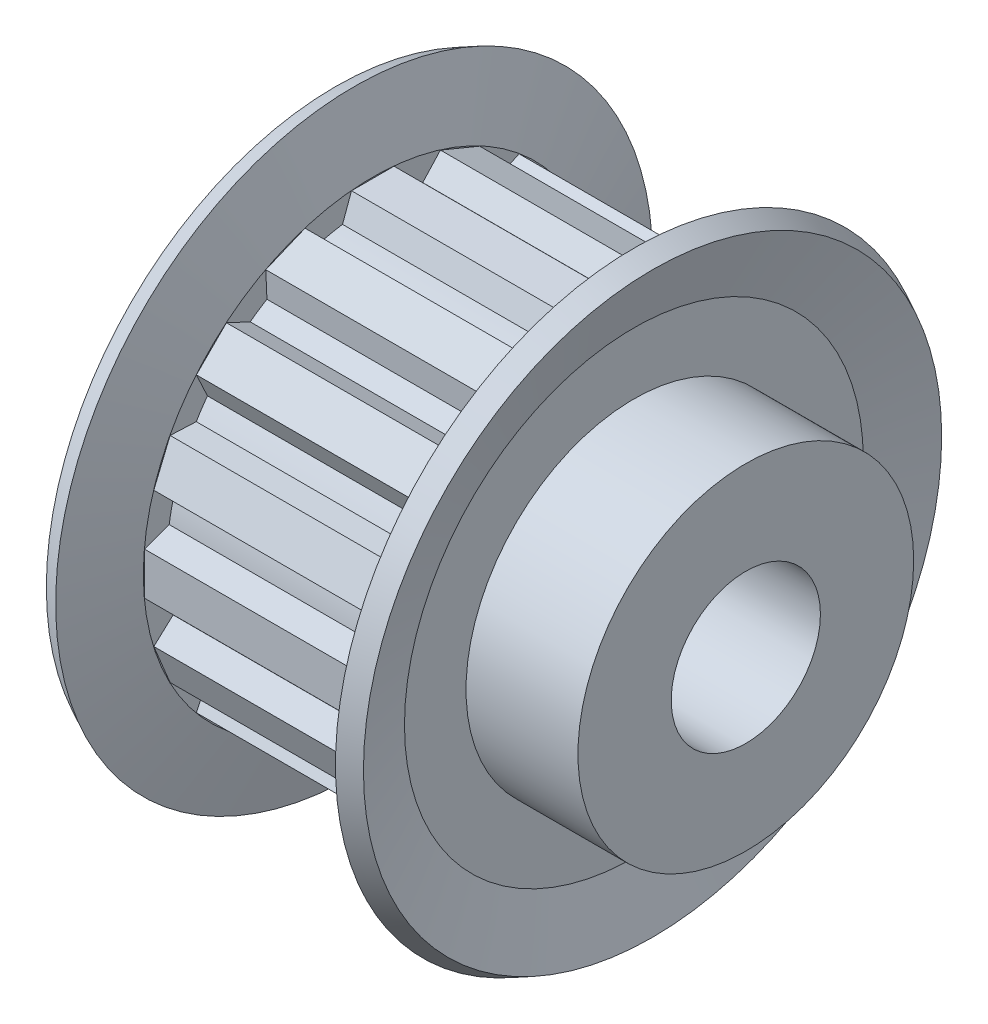
from build123d import *

# Parameters (mm, degrees)
SKETCH2_R                = 9
BOSS_EXTRUDE1_DEPTH      = 6
F_6_0_6_DIAMETER_HOLE1_D = 8
RIB1_REACH               = 28.349
SKETCH5_WALL_W           = 67.697248506
SKETCH5_WALL_H           = 2.28033022
RIB1_DRAFT_ANGLE         = 20
RIB2_REACH               = 28.349
SKETCH6_WALL_W           = 67.697248506
SKETCH6_WALL_H           = 2.28033022
RIB2_DRAFT_ANGLE         = 20
RIB3_REACH               = 28.349
SKETCH7_WALL_W           = 67.697248506
SKETCH7_WALL_H           = 2.28033022
RIB3_DRAFT_ANGLE         = 20
RIB4_REACH               = 28.349
SKETCH8_WALL_W           = 67.697248506
SKETCH8_WALL_H           = 2.28033022
RIB4_DRAFT_ANGLE         = 20
RIB5_REACH               = 28.349
SKETCH9_WALL_W           = 67.697248506
SKETCH9_WALL_H           = 2.28033022
RIB5_DRAFT_ANGLE         = 20
RIB6_REACH               = 28.349
SKETCH10_WALL_W          = 67.697248506
SKETCH10_WALL_H          = 2.28033022
RIB6_DRAFT_ANGLE         = 20
RIB7_REACH               = 28.349
SKETCH11_WALL_W          = 67.697248506
SKETCH11_WALL_H          = 2.28033022
RIB7_DRAFT_ANGLE         = 20
RIB8_REACH               = 28.349
SKETCH12_WALL_W          = 67.697248506
SKETCH12_WALL_H          = 2.28033022
RIB8_DRAFT_ANGLE         = 20
RIB9_REACH               = 28.349
SKETCH13_WALL_W          = 67.697248506
SKETCH13_WALL_H          = 2.28033022
RIB9_DRAFT_ANGLE         = 20
RIB10_REACH              = 28.349
SKETCH14_WALL_W          = 67.697248506
SKETCH14_WALL_H          = 2.28033022
RIB10_DRAFT_ANGLE        = 20
RIB11_REACH              = 28.349
SKETCH15_WALL_W          = 67.697248506
SKETCH15_WALL_H          = 2.28033022
RIB11_DRAFT_ANGLE        = 20
RIB12_REACH              = 28.349
SKETCH16_WALL_W          = 67.697248506
SKETCH16_WALL_H          = 2.28033022
RIB12_DRAFT_ANGLE        = 20
RIB13_REACH              = 28.349
SKETCH17_WALL_W          = 67.697248506
SKETCH17_WALL_H          = 2.28033022
RIB13_DRAFT_ANGLE        = 20
RIB14_REACH              = 28.349
SKETCH18_WALL_W          = 67.697248506
SKETCH18_WALL_H          = 2.28033022
RIB14_DRAFT_ANGLE        = 20
RIB15_REACH              = 28.349
SKETCH19_WALL_W          = 67.697248506
SKETCH19_WALL_H          = 2.28033022
RIB15_DRAFT_ANGLE        = 20
RIB16_REACH              = 28.349
SKETCH20_WALL_W          = 67.697248506
SKETCH20_WALL_H          = 2.28033022
RIB16_DRAFT_ANGLE        = 20


with BuildPart() as part:
    # Sketch1 → Revolve1 (revolve)
    with BuildSketch(Plane.XY, mode=Mode.PRIVATE) as revolve1_sk:
        Polygon((-7.5, 12.3), (-7.5, 0), (7.5, 0), (7.5, 12.3), (8.5, 15.5), (7.5, 16), (6.5, 12.3), (6.5, 11.032395447), (-6.5, 11.032395447), (-6.5, 12.3), (-7.5, 16), (-8.5, 15.5), align=None)
    revolve(revolve1_sk.sketch.rotate(Axis((-8.5, 0, 0), (1, 0, 0)), 270), axis=Axis((-8.5, 0, 0), (1, 0, 0)))

    # Sketch2 → Boss-Extrude1 (add)
    with BuildSketch(Plane(origin=(7.5, 0, 0), x_dir=(0, 0, -1), z_dir=(1, 0, 0))):
        Circle(SKETCH2_R)
    extrude(amount=BOSS_EXTRUDE1_DEPTH)

    # Ø6.0 (6) Diameter Hole1 (through all)
    with Locations(Plane(origin=(13.5, 0, 0), x_dir=(0, 0, -1), z_dir=(1, 0, 0))):
        with Locations((0, 0)):
            Hole(F_6_0_6_DIAMETER_HOLE1_D / 2)

    # Sketch5 wall → Rib1 (add, up to next)
    with BuildSketch(Plane(origin=(0, -12.232395447, 0), x_dir=(1, 0, 0), z_dir=(0, 1, 0)), mode=Mode.PRIVATE) as rib1_sk1:
        Rectangle(SKETCH5_WALL_W, SKETCH5_WALL_H)
    rib1_tool1 = extrude(rib1_sk1.sketch, amount=RIB1_REACH, mode=Mode.PRIVATE) - part.part
    add(rib1_tool1.solids().sort_by_distance((0, -12.232395447, 0))[0])

    # Rib1 draft
    rib1_draft_faces = [part.faces().sort_by_distance(p)[0] for p in [
        (0, -11.732395447, -1.14016511),
        (0, -11.732395447, 1.14016511),
    ]]
    draft(rib1_draft_faces, Plane.XZ.offset(12.232395447), RIB1_DRAFT_ANGLE)

    # Sketch6 wall → Rib2 (add, up to next)
    with BuildSketch(Plane.XY.offset(-12.232395447), mode=Mode.PRIVATE) as rib2_sk1:
        Rectangle(SKETCH6_WALL_W, SKETCH6_WALL_H)
    rib2_tool1 = extrude(rib2_sk1.sketch, amount=RIB2_REACH, mode=Mode.PRIVATE) - part.part
    add(rib2_tool1.solids().sort_by_distance((0, 0, -12.232395447))[0])

    # Rib2 draft
    rib2_draft_faces = [part.faces().sort_by_distance(p)[0] for p in [
        (0, 1.14016511, -11.732395447),
        (0, -1.14016511, -11.732395447),
    ]]
    draft(rib2_draft_faces, Plane(origin=(0, 0, -12.232395447), x_dir=(1, 0, 0), z_dir=(0, 0, -1)), RIB2_DRAFT_ANGLE)

    # Sketch7 wall → Rib3 (add, up to next)
    with BuildSketch(Plane.XZ.offset(-12.232395447), mode=Mode.PRIVATE) as rib3_sk1:
        Rectangle(SKETCH7_WALL_W, SKETCH7_WALL_H)
    rib3_tool1 = extrude(rib3_sk1.sketch, amount=RIB3_REACH, mode=Mode.PRIVATE) - part.part
    add(rib3_tool1.solids().sort_by_distance((0, 12.232395447, 0))[0])

    # Rib3 draft
    rib3_draft_faces = [part.faces().sort_by_distance(p)[0] for p in [
        (0, 11.732395447, 1.14016511),
        (0, 11.732395447, -1.14016511),
    ]]
    draft(rib3_draft_faces, Plane(origin=(0, 12.232395447, 0), x_dir=(1, 0, 0), z_dir=(0, 1, 0)), RIB3_DRAFT_ANGLE)

    # Sketch8 wall → Rib4 (add, up to next)
    with BuildSketch(Plane(origin=(0, 0, 12.232395447), x_dir=(1, 0, 0), z_dir=(0, 0, -1)), mode=Mode.PRIVATE) as rib4_sk1:
        Rectangle(SKETCH8_WALL_W, SKETCH8_WALL_H)
    rib4_tool1 = extrude(rib4_sk1.sketch, amount=RIB4_REACH, mode=Mode.PRIVATE) - part.part
    add(rib4_tool1.solids().sort_by_distance((0, 0, 12.232395447))[0])

    # Rib4 draft
    rib4_draft_faces = [part.faces().sort_by_distance(p)[0] for p in [
        (0, -1.14016511, 11.732395447),
        (0, 1.14016511, 11.732395447),
    ]]
    draft(rib4_draft_faces, Plane.XY.offset(12.232395447), RIB4_DRAFT_ANGLE)

    # Sketch9 wall → Rib5 (add, up to next)
    with BuildSketch(Plane(origin=(0, 8.649609771, 8.649609771), x_dir=(1, 0, 0), z_dir=(0, -0.707106781187, -0.707106781187)), mode=Mode.PRIVATE) as rib5_sk1:
        Rectangle(SKETCH9_WALL_W, SKETCH9_WALL_H)
    rib5_tool1 = extrude(rib5_sk1.sketch, amount=RIB5_REACH, mode=Mode.PRIVATE) - part.part
    add(rib5_tool1.solids().sort_by_distance((0, 8.649609771, 8.649609771))[0])

    # Rib5 draft
    rib5_draft_faces = [part.faces().sort_by_distance(p)[0] for p in [
        (0, 7.4898379, 9.102274861),
        (0, 9.102274861, 7.4898379),
    ]]
    draft(rib5_draft_faces, Plane(origin=(0, 8.649609771, 8.649609771), x_dir=(1, 0, 0), z_dir=(0, 0.707106781187, 0.707106781187)), RIB5_DRAFT_ANGLE)

    # Sketch10 wall → Rib6 (add, up to next)
    with BuildSketch(Plane(origin=(0, 11.301259787, 4.681135076), x_dir=(1, 0, 0), z_dir=(0, -0.923879532511, -0.382683432365)), mode=Mode.PRIVATE) as rib6_sk1:
        Rectangle(SKETCH10_WALL_W, SKETCH10_WALL_H)
    rib6_tool1 = extrude(rib6_sk1.sketch, amount=RIB6_REACH, mode=Mode.PRIVATE) - part.part
    add(rib6_tool1.solids().sort_by_distance((0, 11.301259787, 4.681135076))[0])

    # Rib6 draft
    rib6_draft_faces = [part.faces().sort_by_distance(p)[0] for p in [
        (0, 10.402997723, 5.543168569),
        (0, 11.275642318, 3.436418151),
    ]]
    draft(rib6_draft_faces, Plane(origin=(0, 11.301259787, 4.681135076), x_dir=(1, 0, 0), z_dir=(0, 0.923879532511, 0.382683432365)), RIB6_DRAFT_ANGLE)

    # Sketch11 wall → Rib7 (add, up to next)
    with BuildSketch(Plane(origin=(0, 4.681135076, -11.301259787), x_dir=(1, 0, 0), z_dir=(0, -0.382683432365, 0.923879532511)), mode=Mode.PRIVATE) as rib7_sk1:
        Rectangle(SKETCH11_WALL_W, SKETCH11_WALL_H)
    rib7_tool1 = extrude(rib7_sk1.sketch, amount=RIB7_REACH, mode=Mode.PRIVATE) - part.part
    add(rib7_tool1.solids().sort_by_distance((0, 4.681135076, -11.301259787))[0])

    # Rib7 draft
    rib7_draft_faces = [part.faces().sort_by_distance(p)[0] for p in [
        (0, 5.543168569, -10.402997723),
        (0, 3.436418151, -11.275642318),
    ]]
    draft(rib7_draft_faces, Plane(origin=(0, 4.681135076, -11.301259787), x_dir=(1, 0, 0), z_dir=(0, 0.382683432365, -0.923879532511)), RIB7_DRAFT_ANGLE)

    # Sketch12 wall → Rib8 (add, up to next)
    with BuildSketch(Plane(origin=(0, 4.681135076, 11.301259787), x_dir=(1, 0, 0), z_dir=(0, -0.382683432365, -0.923879532511)), mode=Mode.PRIVATE) as rib8_sk1:
        Rectangle(SKETCH12_WALL_W, SKETCH12_WALL_H)
    rib8_tool1 = extrude(rib8_sk1.sketch, amount=RIB8_REACH, mode=Mode.PRIVATE) - part.part
    add(rib8_tool1.solids().sort_by_distance((0, 4.681135076, 11.301259787))[0])

    # Rib8 draft
    rib8_draft_faces = [part.faces().sort_by_distance(p)[0] for p in [
        (0, 3.436418151, 11.275642318),
        (0, 5.543168569, 10.402997723),
    ]]
    draft(rib8_draft_faces, Plane(origin=(0, 4.681135076, 11.301259787), x_dir=(1, 0, 0), z_dir=(0, 0.382683432365, 0.923879532511)), RIB8_DRAFT_ANGLE)

    # Sketch13 wall → Rib9 (add, up to next)
    with BuildSketch(Plane(origin=(0, -8.649609771, 8.649609771), x_dir=(1, 0, 0), z_dir=(0, 0.707106781187, -0.707106781187)), mode=Mode.PRIVATE) as rib9_sk1:
        Rectangle(SKETCH13_WALL_W, SKETCH13_WALL_H)
    rib9_tool1 = extrude(rib9_sk1.sketch, amount=RIB9_REACH, mode=Mode.PRIVATE) - part.part
    add(rib9_tool1.solids().sort_by_distance((0, -8.649609771, 8.649609771))[0])

    # Rib9 draft
    rib9_draft_faces = [part.faces().sort_by_distance(p)[0] for p in [
        (0, -9.102274861, 7.4898379),
        (0, -7.4898379, 9.102274861),
    ]]
    draft(rib9_draft_faces, Plane(origin=(0, -8.649609771, 8.649609771), x_dir=(1, 0, 0), z_dir=(0, -0.707106781187, 0.707106781187)), RIB9_DRAFT_ANGLE)

    # Sketch14 wall → Rib10 (add, up to next)
    with BuildSketch(Plane(origin=(0, 8.649609771, -8.649609771), x_dir=(1, 0, 0), z_dir=(0, -0.707106781187, 0.707106781187)), mode=Mode.PRIVATE) as rib10_sk1:
        Rectangle(SKETCH14_WALL_W, SKETCH14_WALL_H)
    rib10_tool1 = extrude(rib10_sk1.sketch, amount=RIB10_REACH, mode=Mode.PRIVATE) - part.part
    add(rib10_tool1.solids().sort_by_distance((0, 8.649609771, -8.649609771))[0])

    # Rib10 draft
    rib10_draft_faces = [part.faces().sort_by_distance(p)[0] for p in [
        (0, 9.102274861, -7.4898379),
        (0, 7.4898379, -9.102274861),
    ]]
    draft(rib10_draft_faces, Plane(origin=(0, 8.649609771, -8.649609771), x_dir=(1, 0, 0), z_dir=(0, 0.707106781187, -0.707106781187)), RIB10_DRAFT_ANGLE)

    # Sketch15 wall → Rib11 (add, up to next)
    with BuildSketch(Plane(origin=(0, -8.649609771, -8.649609771), x_dir=(1, 0, 0), z_dir=(0, 0.707106781187, 0.707106781187)), mode=Mode.PRIVATE) as rib11_sk1:
        Rectangle(SKETCH15_WALL_W, SKETCH15_WALL_H)
    rib11_tool1 = extrude(rib11_sk1.sketch, amount=RIB11_REACH, mode=Mode.PRIVATE) - part.part
    add(rib11_tool1.solids().sort_by_distance((0, -8.649609771, -8.649609771))[0])

    # Rib11 draft
    rib11_draft_faces = [part.faces().sort_by_distance(p)[0] for p in [
        (0, -7.4898379, -9.102274861),
        (0, -9.102274861, -7.4898379),
    ]]
    draft(rib11_draft_faces, Plane(origin=(0, -8.649609771, -8.649609771), x_dir=(1, 0, 0), z_dir=(0, -0.707106781187, -0.707106781187)), RIB11_DRAFT_ANGLE)

    # Sketch16 wall → Rib12 (add, up to next)
    with BuildSketch(Plane(origin=(0, 11.301259787, -4.681135076), x_dir=(1, 0, 0), z_dir=(0, -0.923879532511, 0.382683432365)), mode=Mode.PRIVATE) as rib12_sk1:
        Rectangle(SKETCH16_WALL_W, SKETCH16_WALL_H)
    rib12_tool1 = extrude(rib12_sk1.sketch, amount=RIB12_REACH, mode=Mode.PRIVATE) - part.part
    add(rib12_tool1.solids().sort_by_distance((0, 11.301259787, -4.681135076))[0])

    # Rib12 draft
    rib12_draft_faces = [part.faces().sort_by_distance(p)[0] for p in [
        (0, 11.275642318, -3.436418151),
        (0, 10.402997723, -5.543168569),
    ]]
    draft(rib12_draft_faces, Plane(origin=(0, 11.301259787, -4.681135076), x_dir=(1, 0, 0), z_dir=(0, 0.923879532511, -0.382683432365)), RIB12_DRAFT_ANGLE)

    # Sketch17 wall → Rib13 (add, up to next)
    with BuildSketch(Plane(origin=(0, -11.301259787, -4.681135076), x_dir=(1, 0, 0), z_dir=(0, 0.923879532511, 0.382683432365)), mode=Mode.PRIVATE) as rib13_sk1:
        Rectangle(SKETCH17_WALL_W, SKETCH17_WALL_H)
    rib13_tool1 = extrude(rib13_sk1.sketch, amount=RIB13_REACH, mode=Mode.PRIVATE) - part.part
    add(rib13_tool1.solids().sort_by_distance((0, -11.301259787, -4.681135076))[0])

    # Rib13 draft
    rib13_draft_faces = [part.faces().sort_by_distance(p)[0] for p in [
        (0, -10.402997723, -5.543168569),
        (0, -11.275642318, -3.436418151),
    ]]
    draft(rib13_draft_faces, Plane(origin=(0, -11.301259787, -4.681135076), x_dir=(1, 0, 0), z_dir=(0, -0.923879532511, -0.382683432365)), RIB13_DRAFT_ANGLE)

    # Sketch18 wall → Rib14 (add, up to next)
    with BuildSketch(Plane(origin=(0, -4.681135076, 11.301259787), x_dir=(1, 0, 0), z_dir=(0, 0.382683432365, -0.923879532511)), mode=Mode.PRIVATE) as rib14_sk1:
        Rectangle(SKETCH18_WALL_W, SKETCH18_WALL_H)
    rib14_tool1 = extrude(rib14_sk1.sketch, amount=RIB14_REACH, mode=Mode.PRIVATE) - part.part
    add(rib14_tool1.solids().sort_by_distance((0, -4.681135076, 11.301259787))[0])

    # Rib14 draft
    rib14_draft_faces = [part.faces().sort_by_distance(p)[0] for p in [
        (0, -5.543168569, 10.402997723),
        (0, -3.436418151, 11.275642318),
    ]]
    draft(rib14_draft_faces, Plane(origin=(0, -4.681135076, 11.301259787), x_dir=(1, 0, 0), z_dir=(0, -0.382683432365, 0.923879532511)), RIB14_DRAFT_ANGLE)

    # Sketch19 wall → Rib15 (add, up to next)
    with BuildSketch(Plane(origin=(0, -4.681135076, -11.301259787), x_dir=(1, 0, 0), z_dir=(0, 0.382683432365, 0.923879532511)), mode=Mode.PRIVATE) as rib15_sk1:
        Rectangle(SKETCH19_WALL_W, SKETCH19_WALL_H)
    rib15_tool1 = extrude(rib15_sk1.sketch, amount=RIB15_REACH, mode=Mode.PRIVATE) - part.part
    add(rib15_tool1.solids().sort_by_distance((0, -4.681135076, -11.301259787))[0])

    # Rib15 draft
    rib15_draft_faces = [part.faces().sort_by_distance(p)[0] for p in [
        (0, -3.436418151, -11.275642318),
        (0, -5.543168569, -10.402997723),
    ]]
    draft(rib15_draft_faces, Plane(origin=(0, -4.681135076, -11.301259787), x_dir=(1, 0, 0), z_dir=(0, -0.382683432365, -0.923879532511)), RIB15_DRAFT_ANGLE)

    # Sketch20 wall → Rib16 (add, up to next)
    with BuildSketch(Plane(origin=(0, -11.301259787, 4.681135076), x_dir=(1, 0, 0), z_dir=(0, 0.923879532511, -0.382683432365)), mode=Mode.PRIVATE) as rib16_sk1:
        Rectangle(SKETCH20_WALL_W, SKETCH20_WALL_H)
    rib16_tool1 = extrude(rib16_sk1.sketch, amount=RIB16_REACH, mode=Mode.PRIVATE) - part.part
    add(rib16_tool1.solids().sort_by_distance((0, -11.301259787, 4.681135076))[0])

    # Rib16 draft
    rib16_draft_faces = [part.faces().sort_by_distance(p)[0] for p in [
        (0, -11.275642318, 3.436418151),
        (0, -10.402997723, 5.543168569),
    ]]
    draft(rib16_draft_faces, Plane(origin=(0, -11.301259787, 4.681135076), x_dir=(1, 0, 0), z_dir=(0, -0.923879532511, 0.382683432365)), RIB16_DRAFT_ANGLE)


solid = part.part
